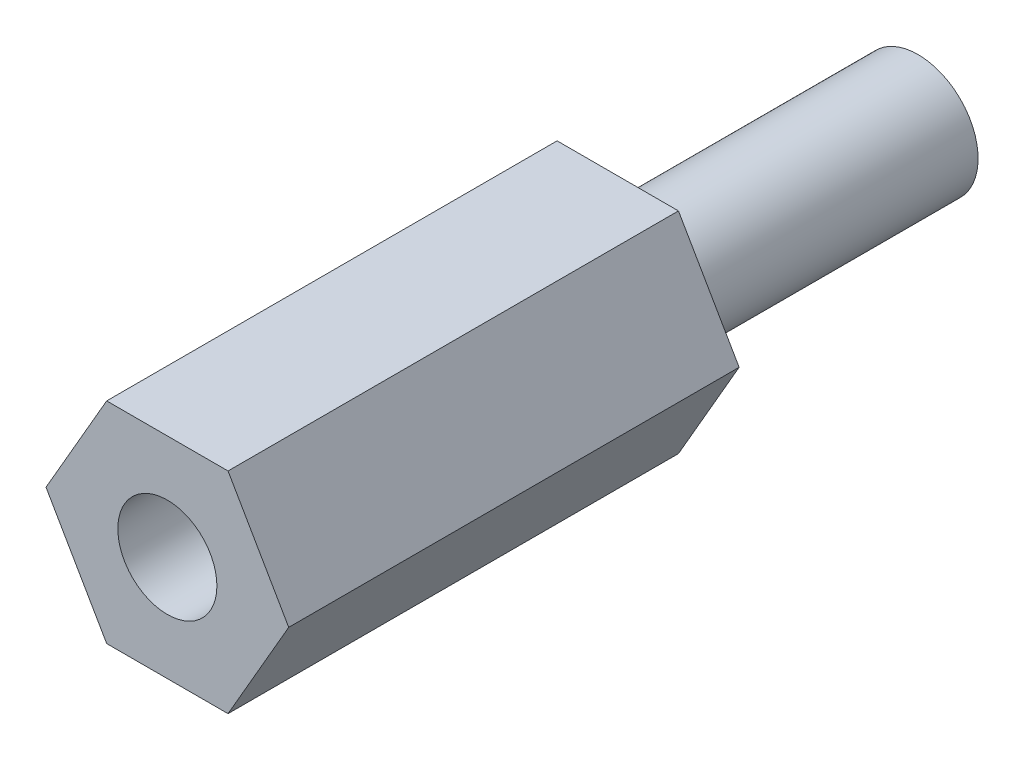
from build123d import *

# Parameters (mm, degrees)
EXTRUDE_1_DEPTH = 15
SKETCH_4_R      = 2
EXTRUDE_2_DEPTH = 10
M4X0_7_1_D      = 3.3
M4X0_7_1_DEPTH  = 10.1
M4X0_7_1_TIP    = 0.991420021


with BuildPart() as part:
    # 草圖1 → 填料-伸長1 (new body)
    with BuildSketch(Plane.XY):
        Polygon((-2.020725942, 3.5), (-4.041451884, 0), (-2.020725942, -3.5), (2.020725942, -3.5), (4.041451884, 0), (2.020725942, 3.5), align=None)
    extrude(amount=EXTRUDE_1_DEPTH)

    # 草圖4 → 填料-伸長2 (add)
    with BuildSketch(Plane(origin=(0, 0, 0), x_dir=(-1, 0, 0), z_dir=(0, 0, -1))):
        Circle(SKETCH_4_R)
    extrude(amount=EXTRUDE_2_DEPTH)

    # M4x0.7 螺紋孔1
    with Locations(Plane.XY.offset(15)):
        with Locations((0, 0)):
            Hole(M4X0_7_1_D / 2, depth=M4X0_7_1_DEPTH)
            with Locations((0, 0, -(M4X0_7_1_DEPTH + M4X0_7_1_TIP / 2))):  # 118° drill point
                Cone(0, M4X0_7_1_D / 2, M4X0_7_1_TIP, mode=Mode.SUBTRACT)


solid = part.part
